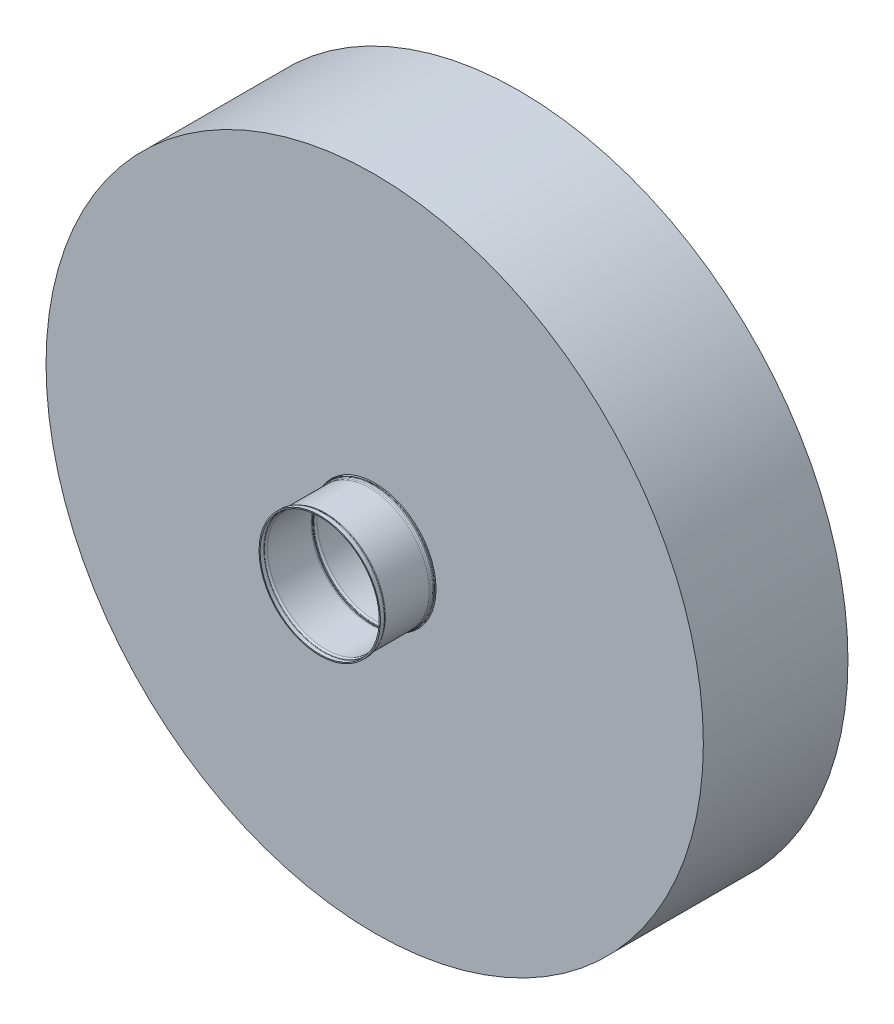
from build123d import *
from build123d.topology import SkipClean

# Parameters (mm, degrees)
SKETCH1_R             = 150
SKETCH1_R_2           = 28
BOSS_EXTRUDE1_DEPTH   = 66
BOSS_EXTRUDE4_START   = -4
SKETCH5_R             = 3.6
SKETCH5_R_2           = 1.6
BOSS_EXTRUDE4_DEPTH   = 4
BOSS_EXTRUDE4_2_DEPTH = 4
BOSS_EXTRUDE4_3_DEPTH = 4
BOSS_EXTRUDE4_4_DEPTH = 4
BOSS_EXTRUDE4_5_DEPTH = 4
BOSS_EXTRUDE4_6_DEPTH = 4
BOSS_EXTRUDE4_7_DEPTH = 4
SKETCH5_R_3           = 4
BOSS_EXTRUDE4_8_DEPTH = 4
SKETCH6_R             = 4
BOSS_EXTRUDE5_DEPTH   = 4


with BuildPart() as part:
    # Sketch1 → Boss-Extrude1 (new body)
    with BuildSketch(Plane.XY):
        Circle(SKETCH1_R)
        Circle(SKETCH1_R_2, mode=Mode.SUBTRACT)
    extrude(amount=BOSS_EXTRUDE1_DEPTH)


with BuildPart() as body_2:
    # Sketch3 → Revolve1 (revolve)
    with BuildSketch(Plane(origin=(0, 0, 0), x_dir=(0, 0, -1), z_dir=(1, 0, 0)), mode=Mode.PRIVATE) as revolve1_sk:
        with BuildLine():
            Line((2.33137085, 27.2), (22.257086418, 27.2))
            ThreePointArc((22.257086418, 27.2), (22.563233164, 27.260896374), (22.822771843, 27.434314575))
            Line((22.822771843, 27.434314575), (22.854142693, 27.465685425))
            ThreePointArc((22.854142693, 27.465685425), (23.113681372, 27.639103626), (23.419828118, 27.7))
            Line((23.419828118, 27.7), (25.088457268, 27.7))
            Line((25.088457268, 27.7), (25.088457268, 27.2))
            Line((25.088457268, 27.2), (23.419828118, 27.2))
            ThreePointArc((23.419828118, 27.2), (23.305023088, 27.17716386), (23.207696084, 27.112132034))
            Line((23.207696084, 27.112132034), (23.176325234, 27.080761184))
            ThreePointArc((23.176325234, 27.080761184), (22.75457488, 26.798956608), (22.257086418, 26.7))
            Line((22.257086418, 26.7), (2.33137085, 26.7))
            ThreePointArc((2.33137085, 26.7), (1.833882388, 26.798956608), (1.412132034, 27.080761184))
            Line((1.412132034, 27.080761184), (1.380761184, 27.112132034))
            ThreePointArc((1.380761184, 27.112132034), (1.28343418, 27.17716386), (1.16862915, 27.2))
            Line((1.16862915, 27.2), (0.83137085, 27.2))
            ThreePointArc((0.83137085, 27.2), (0.71656582, 27.17716386), (0.619238816, 27.112132034))
            Line((0.619238816, 27.112132034), (0.587867966, 27.080761184))
            ThreePointArc((0.587867966, 27.080761184), (0.166117612, 26.798956608), (-0.33137085, 26.7))
            Line((-0.33137085, 26.7), (-65.66862915, 26.7))
            ThreePointArc((-65.66862915, 26.7), (-66.166117612, 26.798956608), (-66.587867966, 27.080761184))
            Line((-66.587867966, 27.080761184), (-66.619238816, 27.112132034))
            ThreePointArc((-66.619238816, 27.112132034), (-66.71656582, 27.17716386), (-66.83137085, 27.2))
            Line((-66.83137085, 27.2), (-67.16862915, 27.2))
            ThreePointArc((-67.16862915, 27.2), (-67.28343418, 27.17716386), (-67.380761184, 27.112132034))
            Line((-67.380761184, 27.112132034), (-67.412132034, 27.080761184))
            ThreePointArc((-67.412132034, 27.080761184), (-67.833882388, 26.798956608), (-68.33137085, 26.7))
            Line((-68.33137085, 26.7), (-88.257086418, 26.7))
            ThreePointArc((-88.257086418, 26.7), (-88.75457488, 26.798956608), (-89.176325234, 27.080761184))
            Line((-89.176325234, 27.080761184), (-89.207696084, 27.112132034))
            ThreePointArc((-89.207696084, 27.112132034), (-89.305023088, 27.17716386), (-89.419828118, 27.2))
            Line((-89.419828118, 27.2), (-91.088457268, 27.2))
            Line((-91.088457268, 27.2), (-91.088457268, 27.7))
            Line((-91.088457268, 27.7), (-89.419828118, 27.7))
            ThreePointArc((-89.419828118, 27.7), (-89.113681372, 27.639103626), (-88.854142693, 27.465685425))
            Line((-88.854142693, 27.465685425), (-88.822771843, 27.434314575))
            ThreePointArc((-88.822771843, 27.434314575), (-88.563233164, 27.260896374), (-88.257086418, 27.2))
            Line((-88.257086418, 27.2), (-68.33137085, 27.2))
            ThreePointArc((-68.33137085, 27.2), (-68.025224104, 27.260896374), (-67.765685425, 27.434314575))
            Line((-67.765685425, 27.434314575), (-67.734314575, 27.465685425))
            ThreePointArc((-67.734314575, 27.465685425), (-67.474775896, 27.639103626), (-67.16862915, 27.7))
            Line((-67.16862915, 27.7), (-66.83137085, 27.7))
            ThreePointArc((-66.83137085, 27.7), (-66.525224104, 27.639103626), (-66.265685425, 27.465685425))
            Line((-66.265685425, 27.465685425), (-66.234314575, 27.434314575))
            ThreePointArc((-66.234314575, 27.434314575), (-65.974775896, 27.260896374), (-65.66862915, 27.2))
            Line((-65.66862915, 27.2), (-0.33137085, 27.2))
            ThreePointArc((-0.33137085, 27.2), (-0.025224104, 27.260896374), (0.234314575, 27.434314575))
            Line((0.234314575, 27.434314575), (0.265685425, 27.465685425))
            ThreePointArc((0.265685425, 27.465685425), (0.525224104, 27.639103626), (0.83137085, 27.7))
            Line((0.83137085, 27.7), (1.16862915, 27.7))
            ThreePointArc((1.16862915, 27.7), (1.474775896, 27.639103626), (1.734314575, 27.465685425))
            Line((1.734314575, 27.465685425), (1.765685425, 27.434314575))
            ThreePointArc((1.765685425, 27.434314575), (2.025224104, 27.260896374), (2.33137085, 27.2))
        make_face()
    revolve(revolve1_sk.sketch.rotate(Axis((0, 0, 0), (0, 0, 1)), 90), axis=Axis((0, 0, 0), (0, 0, 1)))


with BuildPart() as body_3:
    # Sketch5 → Boss-Extrude4 (new body)
    with BuildSketch(Plane.XY.offset(BOSS_EXTRUDE4_START)):
        with Locations((28.326662781, -59.241204136)):
            Circle(SKETCH5_R)
        with Locations((28.326662781, -59.241204136)):
            Circle(SKETCH5_R_2, mode=Mode.SUBTRACT)
    extrude(amount=-BOSS_EXTRUDE4_DEPTH)


with BuildPart() as body_4:
    # Sketch5 → Boss-Extrude4 2 (new body)
    with BuildSketch(Plane.XY.offset(BOSS_EXTRUDE4_START)):
        with Locations((-28.326662781, -59.241204136)):
            Circle(SKETCH5_R)
        with Locations((-28.326662781, -59.241204136)):
            Circle(SKETCH5_R_2, mode=Mode.SUBTRACT)
    extrude(amount=-BOSS_EXTRUDE4_2_DEPTH)


with BuildPart() as body_5:
    # Sketch5 → Boss-Extrude4 3 (new body)
    with BuildSketch(Plane.XY.offset(BOSS_EXTRUDE4_START)):
        with BuildLine():
            Line((0.305212717, -37.776572277), (-0.305212717, -37.776572277))
            ThreePointArc((-0.305212717, -37.776572277), (-2.9611956, -38.540329257), (-4.805768297, -40.598270307))
            ThreePointArc((-4.805768297, -40.598270307), (-14.539249585, -44.747209092), (-19.975116332, -35.669450352))
            ThreePointArc((-19.975116332, -35.669450352), (-20.257779592, -32.920328441), (-21.957589792, -30.741288495))
            Line((-21.957589792, -30.741288495), (-22.451434342, -30.382489427))
            ThreePointArc((-22.451434342, -30.382489427), (-25.04909472, -29.439234235), (-27.751012778, -30.01993089))
            ThreePointArc((-27.751012778, -30.01993089), (-30.524841853, -30.907867996), (-33.433080405, -30.750678418))
            ThreePointArc((-33.433080405, -30.750678418), (-37.696585084, -31.685186218), (-39.601662781, -35.61220238))
            Line((-39.601662781, -35.61220238), (-39.601662781, -64.241204136))
            ThreePointArc((-39.601662781, -64.241204136), (-38.137196687, -67.776738041), (-34.601662781, -69.241204136))
            Line((-34.601662781, -69.241204136), (-22.051662781, -69.241204136))
            ThreePointArc((-22.051662781, -69.241204136), (-18.516128875, -67.776738041), (-17.051662781, -64.241204136))
            Line((-17.051662781, -64.241204136), (-17.051662781, -54.241204136))
            ThreePointArc((-17.051662781, -54.241204136), (-15.587196687, -50.70567023), (-12.051662781, -49.241204136))
            Line((-12.051662781, -49.241204136), (12.051662781, -49.241204136))
            ThreePointArc((12.051662781, -49.241204136), (15.587196687, -50.70567023), (17.051662781, -54.241204136))
            Line((17.051662781, -54.241204136), (17.051662781, -64.241204136))
            ThreePointArc((17.051662781, -64.241204136), (18.516128875, -67.776738041), (22.051662781, -69.241204136))
            Line((22.051662781, -69.241204136), (34.601662781, -69.241204136))
            ThreePointArc((34.601662781, -69.241204136), (38.137196687, -67.776738041), (39.601662781, -64.241204136))
            Line((39.601662781, -64.241204136), (39.601662781, -35.61220238))
            ThreePointArc((39.601662781, -35.61220238), (37.696585084, -31.685186218), (33.433080405, -30.750678418))
            ThreePointArc((33.433080405, -30.750678418), (30.524841853, -30.907867996), (27.751012778, -30.01993089))
            ThreePointArc((27.751012778, -30.01993089), (25.04909472, -29.439234235), (22.451434342, -30.382489427))
            Line((22.451434342, -30.382489427), (21.957589792, -30.741288495))
            ThreePointArc((21.957589792, -30.741288495), (20.257779592, -32.920328441), (19.975116332, -35.669450352))
            ThreePointArc((19.975116332, -35.669450352), (14.539249585, -44.747209092), (4.805768297, -40.598270307))
            ThreePointArc((4.805768297, -40.598270307), (2.9611956, -38.540329257), (0.305212717, -37.776572277))
        make_face()
        with BuildLine():
            Line((37.601662781, -35.61220238), (37.601662781, -64.241204136))
            ThreePointArc((37.601662781, -64.241204136), (36.722983124, -66.362524479), (34.601662781, -67.241204136))
            Line((34.601662781, -67.241204136), (22.051662781, -67.241204136))
            ThreePointArc((22.051662781, -67.241204136), (19.930342437, -66.362524479), (19.051662781, -64.241204136))
            Line((19.051662781, -64.241204136), (19.051662781, -54.241204136))
            ThreePointArc((19.051662781, -54.241204136), (17.001410249, -49.291456667), (12.051662781, -47.241204136))
            Line((12.051662781, -47.241204136), (-12.051662781, -47.241204136))
            ThreePointArc((-12.051662781, -47.241204136), (-17.001410249, -49.291456667), (-19.051662781, -54.241204136))
            Line((-19.051662781, -54.241204136), (-19.051662781, -64.241204136))
            ThreePointArc((-19.051662781, -64.241204136), (-19.930342437, -66.362524479), (-22.051662781, -67.241204136))
            Line((-22.051662781, -67.241204136), (-34.601662781, -67.241204136))
            ThreePointArc((-34.601662781, -67.241204136), (-36.722983124, -66.362524479), (-37.601662781, -64.241204136))
            Line((-37.601662781, -64.241204136), (-37.601662781, -35.61220238))
            ThreePointArc((-37.601662781, -35.61220238), (-36.458616162, -33.255992682), (-33.900513355, -32.695288003))
            ThreePointArc((-33.900513355, -32.695288003), (-30.269731064, -32.891530892), (-26.806751908, -31.782988294))
            ThreePointArc((-26.806751908, -31.782988294), (-25.185601073, -31.434570301), (-23.627004846, -32.000523416))
            Line((-23.627004846, -32.000523416), (-23.133160296, -32.359322484))
            ThreePointArc((-23.133160296, -32.359322484), (-22.113274176, -33.666746451), (-21.94367622, -35.316219598))
            ThreePointArc((-21.94367622, -35.316219598), (-15.157283574, -46.649322124), (-3.005546065, -41.469591095))
            ThreePointArc((-3.005546065, -41.469591095), (-1.898802447, -40.234826465), (-0.305212717, -39.776572277))
            Line((-0.305212717, -39.776572277), (0.305212717, -39.776572277))
            ThreePointArc((0.305212717, -39.776572277), (1.898802447, -40.234826465), (3.005546065, -41.469591095))
            ThreePointArc((3.005546065, -41.469591095), (15.157283574, -46.649322124), (21.94367622, -35.316219598))
            ThreePointArc((21.94367622, -35.316219598), (22.113274176, -33.666746451), (23.133160296, -32.359322484))
            Line((23.133160296, -32.359322484), (23.627004846, -32.000523416))
            ThreePointArc((23.627004846, -32.000523416), (25.185601073, -31.434570301), (26.806751908, -31.782988294))
            ThreePointArc((26.806751908, -31.782988294), (30.269731064, -32.891530892), (33.900513355, -32.695288003))
            ThreePointArc((33.900513355, -32.695288003), (36.458616162, -33.255992682), (37.601662781, -35.61220238))
        make_face(mode=Mode.SUBTRACT)
    extrude(amount=-BOSS_EXTRUDE4_3_DEPTH)



with BuildPart() as body_6:
    # Sketch5 → Boss-Extrude4 4 (new body)
    with BuildSketch(Plane.XY.offset(BOSS_EXTRUDE4_START)):
        with BuildLine():
            Line((19.151662781, -46.450691301), (19.151662781, -64.241204136))
            ThreePointArc((19.151662781, -64.241204136), (20.001053115, -66.291813801), (22.051662781, -67.141204136))
            Line((22.051662781, -67.141204136), (26.276662781, -67.141204136))
            ThreePointArc((26.276662781, -67.141204136), (27.690876343, -66.555417698), (28.276662781, -65.141204136))
            Line((28.276662781, -65.141204136), (28.276662781, -64.559803575))
            ThreePointArc((28.276662781, -64.559803575), (27.925692267, -63.428122633), (26.995961026, -62.693628333))
            ThreePointArc((26.995961026, -62.693628333), (24.626662781, -59.241204136), (26.995961026, -55.788779938))
            ThreePointArc((26.995961026, -55.788779938), (27.925692267, -55.054285638), (28.276662781, -53.922604696))
            Line((28.276662781, -53.922604696), (28.276662781, -52.241204136))
            ThreePointArc((28.276662781, -52.241204136), (28.19144879, -51.531258703), (27.940647769, -50.861644792))
            Line((27.940647769, -50.861644792), (23.846663916, -42.955996098))
            ThreePointArc((23.846663916, -42.955996098), (22.188010492, -41.879147261), (20.414639024, -42.754297667))
            ThreePointArc((20.414639024, -42.754297667), (20.342811824, -42.858946114), (20.269675203, -42.962683662))
            ThreePointArc((20.269675203, -42.962683662), (19.437998218, -44.619288214), (19.151662781, -46.450691301))
        make_face()
        with BuildLine():
            Line((26.164657777, -51.781351021), (22.070673924, -43.875702327))
            ThreePointArc((22.070673924, -43.875702327), (21.984623516, -44.001073239), (21.897004396, -44.125352875))
            ThreePointArc((21.897004396, -44.125352875), (21.342553072, -45.22975591), (21.151662781, -46.450691301))
            Line((21.151662781, -46.450691301), (21.151662781, -64.241204136))
            ThreePointArc((21.151662781, -64.241204136), (21.415266678, -64.877600239), (22.051662781, -65.141204136))
            Line((22.051662781, -65.141204136), (26.276662781, -65.141204136))
            Line((26.276662781, -65.141204136), (26.276662781, -64.559803575))
            ThreePointArc((26.276662781, -64.559803575), (22.626662781, -59.241204136), (26.276662781, -53.922604696))
            Line((26.276662781, -53.922604696), (26.276662781, -52.241204136))
            ThreePointArc((26.276662781, -52.241204136), (26.248258117, -52.004555658), (26.164657777, -51.781351021))
        make_face(mode=Mode.SUBTRACT)
    extrude(amount=-BOSS_EXTRUDE4_4_DEPTH)


with BuildPart() as body_7:
    # Sketch5 → Boss-Extrude4 5 (new body)
    with BuildSketch(Plane.XY.offset(BOSS_EXTRUDE4_START)):
        with BuildLine():
            Line((28.376662781, -53.922604696), (28.376662781, -52.241204136))
            ThreePointArc((28.376662781, -52.241204136), (29.255342437, -50.119883792), (31.376662781, -49.241204136))
            Line((31.376662781, -49.241204136), (32.501662781, -49.241204136))
            ThreePointArc((32.501662781, -49.241204136), (36.037196687, -50.70567023), (37.501662781, -54.241204136))
            Line((37.501662781, -54.241204136), (37.501662781, -64.241204136))
            ThreePointArc((37.501662781, -64.241204136), (36.652272446, -66.291813801), (34.601662781, -67.141204136))
            Line((34.601662781, -67.141204136), (30.376662781, -67.141204136))
            ThreePointArc((30.376662781, -67.141204136), (28.962449218, -66.555417698), (28.376662781, -65.141204136))
            Line((28.376662781, -65.141204136), (28.376662781, -64.559803575))
            ThreePointArc((28.376662781, -64.559803575), (28.727633295, -63.428122633), (29.657364535, -62.693628333))
            ThreePointArc((29.657364535, -62.693628333), (32.026662781, -59.241204136), (29.657364535, -55.788779938))
            ThreePointArc((29.657364535, -55.788779938), (28.727633295, -55.054285638), (28.376662781, -53.922604696))
        make_face()
        with BuildLine():
            Line((31.376662781, -51.241204136), (32.501662781, -51.241204136))
            ThreePointArc((32.501662781, -51.241204136), (34.622983124, -52.119883792), (35.501662781, -54.241204136))
            Line((35.501662781, -54.241204136), (35.501662781, -64.241204136))
            ThreePointArc((35.501662781, -64.241204136), (35.238058884, -64.877600239), (34.601662781, -65.141204136))
            Line((34.601662781, -65.141204136), (30.376662781, -65.141204136))
            Line((30.376662781, -65.141204136), (30.376662781, -64.559803575))
            ThreePointArc((30.376662781, -64.559803575), (34.026662781, -59.241204136), (30.376662781, -53.922604696))
            Line((30.376662781, -53.922604696), (30.376662781, -52.241204136))
            ThreePointArc((30.376662781, -52.241204136), (30.669555999, -51.534097354), (31.376662781, -51.241204136))
        make_face(mode=Mode.SUBTRACT)
    extrude(amount=-BOSS_EXTRUDE4_5_DEPTH)


with BuildPart() as body_8:
    # Sketch5 → Boss-Extrude4 6 (new body)
    with BuildSketch(Plane.XY.offset(BOSS_EXTRUDE4_START)):
        with BuildLine():
            Line((-31.376662781, -49.241204136), (-32.501662781, -49.241204136))
            ThreePointArc((-32.501662781, -49.241204136), (-36.037196687, -50.70567023), (-37.501662781, -54.241204136))
            Line((-37.501662781, -54.241204136), (-37.501662781, -64.241204136))
            ThreePointArc((-37.501662781, -64.241204136), (-36.652272446, -66.291813801), (-34.601662781, -67.141204136))
            Line((-34.601662781, -67.141204136), (-30.376662781, -67.141204136))
            ThreePointArc((-30.376662781, -67.141204136), (-28.962449218, -66.555417698), (-28.376662781, -65.141204136))
            Line((-28.376662781, -65.141204136), (-28.376662781, -64.559803575))
            ThreePointArc((-28.376662781, -64.559803575), (-28.727633295, -63.428122633), (-29.657364535, -62.693628333))
            ThreePointArc((-29.657364535, -62.693628333), (-32.026662781, -59.241204136), (-29.657364535, -55.788779938))
            ThreePointArc((-29.657364535, -55.788779938), (-28.727633295, -55.054285638), (-28.376662781, -53.922604696))
            Line((-28.376662781, -53.922604696), (-28.376662781, -52.241204136))
            ThreePointArc((-28.376662781, -52.241204136), (-29.255342437, -50.119883792), (-31.376662781, -49.241204136))
        make_face()
        with BuildLine():
            Line((-31.376662781, -51.241204136), (-32.501662781, -51.241204136))
            ThreePointArc((-32.501662781, -51.241204136), (-34.622983124, -52.119883792), (-35.501662781, -54.241204136))
            Line((-35.501662781, -54.241204136), (-35.501662781, -64.241204136))
            ThreePointArc((-35.501662781, -64.241204136), (-35.238058884, -64.877600239), (-34.601662781, -65.141204136))
            Line((-34.601662781, -65.141204136), (-30.376662781, -65.141204136))
            Line((-30.376662781, -65.141204136), (-30.376662781, -64.559803575))
            ThreePointArc((-30.376662781, -64.559803575), (-34.026662781, -59.241204136), (-30.376662781, -53.922604696))
            Line((-30.376662781, -53.922604696), (-30.376662781, -52.241204136))
            ThreePointArc((-30.376662781, -52.241204136), (-30.669555999, -51.534097354), (-31.376662781, -51.241204136))
        make_face(mode=Mode.SUBTRACT)
    extrude(amount=-BOSS_EXTRUDE4_6_DEPTH)


with BuildPart() as body_9:
    # Sketch5 → Boss-Extrude4 7 (new body)
    with BuildSketch(Plane.XY.offset(BOSS_EXTRUDE4_START)):
        with BuildLine():
            Line((-27.940647769, -50.861644792), (-23.846663916, -42.955996098))
            ThreePointArc((-23.846663916, -42.955996098), (-22.188010492, -41.879147261), (-20.414639024, -42.754297667))
            ThreePointArc((-20.414639024, -42.754297667), (-20.342811824, -42.858946114), (-20.269675203, -42.962683662))
            ThreePointArc((-20.269675203, -42.962683662), (-19.437998218, -44.619288214), (-19.151662781, -46.450691301))
            Line((-19.151662781, -46.450691301), (-19.151662781, -64.241204136))
            ThreePointArc((-19.151662781, -64.241204136), (-20.001053115, -66.291813801), (-22.051662781, -67.141204136))
            Line((-22.051662781, -67.141204136), (-26.276662781, -67.141204136))
            ThreePointArc((-26.276662781, -67.141204136), (-27.690876343, -66.555417698), (-28.276662781, -65.141204136))
            Line((-28.276662781, -65.141204136), (-28.276662781, -64.559803575))
            ThreePointArc((-28.276662781, -64.559803575), (-27.925692267, -63.428122633), (-26.995961026, -62.693628333))
            ThreePointArc((-26.995961026, -62.693628333), (-24.626662781, -59.241204136), (-26.995961026, -55.788779938))
            ThreePointArc((-26.995961026, -55.788779938), (-27.925692267, -55.054285638), (-28.276662781, -53.922604696))
            Line((-28.276662781, -53.922604696), (-28.276662781, -52.241204136))
            ThreePointArc((-28.276662781, -52.241204136), (-28.19144879, -51.531258703), (-27.940647769, -50.861644792))
        make_face()
        with BuildLine():
            Line((-26.164657777, -51.781351021), (-22.070673924, -43.875702327))
            ThreePointArc((-22.070673924, -43.875702327), (-21.984623516, -44.001073239), (-21.897004396, -44.125352875))
            ThreePointArc((-21.897004396, -44.125352875), (-21.342553072, -45.22975591), (-21.151662781, -46.450691301))
            Line((-21.151662781, -46.450691301), (-21.151662781, -64.241204136))
            ThreePointArc((-21.151662781, -64.241204136), (-21.415266678, -64.877600239), (-22.051662781, -65.141204136))
            Line((-22.051662781, -65.141204136), (-26.276662781, -65.141204136))
            Line((-26.276662781, -65.141204136), (-26.276662781, -64.559803575))
            ThreePointArc((-26.276662781, -64.559803575), (-22.626662781, -59.241204136), (-26.276662781, -53.922604696))
            Line((-26.276662781, -53.922604696), (-26.276662781, -52.241204136))
            ThreePointArc((-26.276662781, -52.241204136), (-26.248258117, -52.004555658), (-26.164657777, -51.781351021))
        make_face(mode=Mode.SUBTRACT)
    extrude(amount=-BOSS_EXTRUDE4_7_DEPTH)


with BuildPart() as body_10:
    # Sketch5 → Boss-Extrude4 8 (new body)
    with BuildSketch(Plane.XY.offset(BOSS_EXTRUDE4_START)):
        with BuildLine():
            ThreePointArc((25.503373671, -28.159863838), (38.944226537, -19.865847687), (23.571727074, -23.489863405))
            ThreePointArc((23.571727074, -23.489863405), (23.434080888, -24.373242778), (22.925289594, -25.108386986))
            ThreePointArc((22.925289594, -25.108386986), (19.984698578, -27.506577809), (16.795190972, -29.562164336))
            ThreePointArc((16.795190972, -29.562164336), (15.938802125, -29.818881559), (15.056123405, -29.676811621))
            ThreePointArc((15.056123405, -29.676811621), (9.579526826, -29.482752005), (5.262932502, -32.858812235))
            ThreePointArc((5.262932502, -32.858812235), (4.632337031, -33.492574762), (3.788609303, -33.788258901))
            ThreePointArc((3.788609303, -33.788258901), (0, -34), (-3.788609303, -33.788258901))
            ThreePointArc((-3.788609303, -33.788258901), (-4.632337031, -33.492574762), (-5.262932502, -32.858812235))
            ThreePointArc((-5.262932502, -32.858812235), (-9.579526826, -29.482752005), (-15.056123405, -29.676811621))
            ThreePointArc((-15.056123405, -29.676811621), (-15.938802125, -29.818881559), (-16.795190972, -29.562164336))
            ThreePointArc((-16.795190972, -29.562164336), (-19.984698578, -27.506577809), (-22.925289594, -25.108386986))
            ThreePointArc((-22.925289594, -25.108386986), (-23.434080888, -24.373242778), (-23.571727074, -23.489863405))
            ThreePointArc((-23.571727074, -23.489863405), (-38.944226537, -19.865847687), (-25.503373671, -28.159863838))
            ThreePointArc((-25.503373671, -28.159863838), (-24.16502505, -27.476482851), (-22.728601321, -27.917927609))
            ThreePointArc((-22.728601321, -27.917927609), (-21.160269083, -29.124611797), (-19.528002908, -30.243298471))
            ThreePointArc((-19.528002908, -30.243298471), (-18.66428465, -31.473004687), (-18.900646123, -32.957026203))
            ThreePointArc((-18.900646123, -32.957026203), (-14.523798736, -44.699656266), (-4.080710043, -37.772315332))
            ThreePointArc((-4.080710043, -37.772315332), (-3.399644531, -36.432786918), (-1.978078603, -35.945614545))
            ThreePointArc((-1.978078603, -35.945614545), (0, -36), (1.978078603, -35.945614545))
            ThreePointArc((1.978078603, -35.945614545), (3.399644531, -36.432786918), (4.080710043, -37.772315332))
            ThreePointArc((4.080710043, -37.772315332), (14.523798736, -44.699656266), (18.900646123, -32.957026203))
            ThreePointArc((18.900646123, -32.957026203), (18.66428465, -31.473004687), (19.528002908, -30.243298471))
            ThreePointArc((19.528002908, -30.243298471), (21.160269083, -29.124611797), (22.728601321, -27.917927609))
            ThreePointArc((22.728601321, -27.917927609), (24.16502505, -27.476482851), (25.503373671, -28.159863838))
        make_face()
        with Locations((31.551662781, -22.923624839)):
            Circle(SKETCH5_R_3, mode=Mode.SUBTRACT)
        with Locations((12.051662781, -37.091204136)):
            Circle(SKETCH5_R_3, mode=Mode.SUBTRACT)
        with Locations((-12.051662781, -37.091204136)):
            Circle(SKETCH5_R_3, mode=Mode.SUBTRACT)
        with Locations((-31.551662781, -22.923624839)):
            Circle(SKETCH5_R_3, mode=Mode.SUBTRACT)
    extrude(amount=-BOSS_EXTRUDE4_8_DEPTH)


with BuildPart() as body_5_1:
    with SkipClean():  # the faces are left unmerged after this step: merging them gives an invalid solid
        add(body_5.part)

        add(body_10.part)  # Boss-Extrude5 merges body 10
        # Sketch6 → Boss-Extrude5 (add)
        # profile 1 of 2: a face of its own
        with BuildSketch(Plane(origin=(0, 0, -8), x_dir=(-1, 0, 0), z_dir=(0, 0, -1))):
            with BuildLine():
                Line((-36.601662781, -49.241204136), (36.601662781, -49.241204136))
                ThreePointArc((36.601662781, -49.241204136), (38.722983124, -48.362524479), (39.601662781, -46.241204136))
                Line((39.601662781, -46.241204136), (39.601662781, -35.663620915))
                ThreePointArc((39.601662781, -35.663620915), (37.698385993, -31.738024738), (33.437540643, -30.801026993))
                ThreePointArc((33.437540643, -30.801026993), (30.239829546, -30.916690182), (27.246835897, -29.784999738))
                ThreePointArc((27.246835897, -29.784999738), (24.77215877, -29.465938934), (22.451434342, -30.382489427))
                Line((22.451434342, -30.382489427), (21.957589792, -30.741288495))
                ThreePointArc((21.957589792, -30.741288495), (20.368755184, -32.665198907), (19.907482754, -35.117351925))
                ThreePointArc((19.907482754, -35.117351925), (14.554700435, -44.794761918), (4.535969698, -40.111859278))
                ThreePointArc((4.535969698, -40.111859278), (2.721453082, -38.399154945), (0.305212717, -37.776572277))
                Line((0.305212717, -37.776572277), (-0.305212717, -37.776572277))
                ThreePointArc((-0.305212717, -37.776572277), (-2.721453082, -38.399154945), (-4.535969698, -40.111859278))
                ThreePointArc((-4.535969698, -40.111859278), (-14.554700435, -44.794761918), (-19.907482754, -35.117351925))
                ThreePointArc((-19.907482754, -35.117351925), (-20.368755184, -32.665198907), (-21.957589792, -30.741288495))
                Line((-21.957589792, -30.741288495), (-22.451434342, -30.382489427))
                ThreePointArc((-22.451434342, -30.382489427), (-24.77215877, -29.465938934), (-27.246835897, -29.784999738))
                ThreePointArc((-27.246835897, -29.784999738), (-30.239829546, -30.916690182), (-33.437540643, -30.801026993))
                ThreePointArc((-33.437540643, -30.801026993), (-37.698385993, -31.738024738), (-39.601662781, -35.663620915))
                Line((-39.601662781, -35.663620915), (-39.601662781, -46.241204136))
                ThreePointArc((-39.601662781, -46.241204136), (-38.722983124, -48.362524479), (-36.601662781, -49.241204136))
            make_face()
            with BuildLine():
                Line((-23.627004846, -32.000523416), (-23.133160296, -32.359322484))
                ThreePointArc((-23.133160296, -32.359322484), (-22.212046636, -33.447111002), (-21.896947245, -34.837235675))
                ThreePointArc((-21.896947245, -34.837235675), (-15.172734424, -46.69687495), (-2.761810915, -41.054618359))
                ThreePointArc((-2.761810915, -41.054618359), (-1.68979537, -40.115194649), (-0.305212717, -39.776572277))
                Line((-0.305212717, -39.776572277), (0.305212717, -39.776572277))
                ThreePointArc((0.305212717, -39.776572277), (1.68979537, -40.115194649), (2.761810915, -41.054618359))
                ThreePointArc((2.761810915, -41.054618359), (15.172734424, -46.69687495), (21.896947245, -34.837235675))
                ThreePointArc((21.896947245, -34.837235675), (22.212046636, -33.447111002), (23.133160296, -32.359322484))
                Line((23.133160296, -32.359322484), (23.627004846, -32.000523416))
                ThreePointArc((23.627004846, -32.000523416), (24.946192979, -31.460637406), (26.365651175, -31.590532225))
                ThreePointArc((26.365651175, -31.590532225), (30.021175966, -32.906991511), (33.903189498, -32.746064562))
                ThreePointArc((33.903189498, -32.746064562), (36.459696708, -33.308263209), (37.601662781, -35.663620915))
                Line((37.601662781, -35.663620915), (37.601662781, -46.241204136))
                ThreePointArc((37.601662781, -46.241204136), (37.308769562, -46.948310917), (36.601662781, -47.241204136))
                Line((36.601662781, -47.241204136), (-36.601662781, -47.241204136))
                ThreePointArc((-36.601662781, -47.241204136), (-37.308769562, -46.948310917), (-37.601662781, -46.241204136))
                Line((-37.601662781, -46.241204136), (-37.601662781, -35.663620915))
                ThreePointArc((-37.601662781, -35.663620915), (-36.459696708, -33.308263209), (-33.903189498, -32.746064562))
                ThreePointArc((-33.903189498, -32.746064562), (-30.021175966, -32.906991511), (-26.365651175, -31.590532225))
                ThreePointArc((-26.365651175, -31.590532225), (-24.946192979, -31.460637406), (-23.627004846, -32.000523416))
            make_face(mode=Mode.SUBTRACT)
        # profile 2 of 2: a face of its own
        with BuildSketch(Plane(origin=(0, 0, -8), x_dir=(-1, 0, 0), z_dir=(0, 0, -1))):
            with BuildLine():
                ThreePointArc((-23.571727074, -23.489863405), (-38.944226537, -19.865847687), (-25.503373671, -28.159863838))
                ThreePointArc((-25.503373671, -28.159863838), (-24.16502505, -27.476482851), (-22.728601321, -27.917927609))
                ThreePointArc((-22.728601321, -27.917927609), (-21.160269083, -29.124611797), (-19.528002908, -30.243298471))
                ThreePointArc((-19.528002908, -30.243298471), (-18.66428465, -31.473004687), (-18.900646123, -32.957026203))
                ThreePointArc((-18.900646123, -32.957026203), (-14.523798736, -44.699656266), (-4.080710043, -37.772315332))
                ThreePointArc((-4.080710043, -37.772315332), (-3.399644531, -36.432786918), (-1.978078603, -35.945614545))
                ThreePointArc((-1.978078603, -35.945614545), (0, -36), (1.978078603, -35.945614545))
                ThreePointArc((1.978078603, -35.945614545), (3.399644531, -36.432786918), (4.080710043, -37.772315332))
                ThreePointArc((4.080710043, -37.772315332), (14.523798736, -44.699656266), (18.900646123, -32.957026203))
                ThreePointArc((18.900646123, -32.957026203), (18.66428465, -31.473004687), (19.528002908, -30.243298471))
                ThreePointArc((19.528002908, -30.243298471), (21.160269083, -29.124611797), (22.728601321, -27.917927609))
                ThreePointArc((22.728601321, -27.917927609), (24.16502505, -27.476482851), (25.503373671, -28.159863838))
                ThreePointArc((25.503373671, -28.159863838), (38.944226537, -19.865847687), (23.571727074, -23.489863405))
                ThreePointArc((23.571727074, -23.489863405), (23.434080888, -24.373242778), (22.925289594, -25.108386986))
                ThreePointArc((22.925289594, -25.108386986), (19.984698578, -27.506577809), (16.795190972, -29.562164336))
                ThreePointArc((16.795190972, -29.562164336), (15.938802125, -29.818881559), (15.056123405, -29.676811621))
                ThreePointArc((15.056123405, -29.676811621), (9.579526826, -29.482752005), (5.262932502, -32.858812235))
                ThreePointArc((5.262932502, -32.858812235), (4.632337031, -33.492574762), (3.788609303, -33.788258901))
                ThreePointArc((3.788609303, -33.788258901), (0, -34), (-3.788609303, -33.788258901))
                ThreePointArc((-3.788609303, -33.788258901), (-4.632337031, -33.492574762), (-5.262932502, -32.858812235))
                ThreePointArc((-5.262932502, -32.858812235), (-9.579526826, -29.482752005), (-15.056123405, -29.676811621))
                ThreePointArc((-15.056123405, -29.676811621), (-15.938802125, -29.818881559), (-16.795190972, -29.562164336))
                ThreePointArc((-16.795190972, -29.562164336), (-19.984698578, -27.506577809), (-22.925289594, -25.108386986))
                ThreePointArc((-22.925289594, -25.108386986), (-23.434080888, -24.373242778), (-23.571727074, -23.489863405))
            make_face()
            with Locations(Location((31.551662781, -22.923624839, 0), (0, 0, 180))):
                Circle(SKETCH6_R, mode=Mode.SUBTRACT)
            with Locations(Location((12.051662781, -37.091204136, 0), (0, 0, 180))):
                Circle(SKETCH6_R, mode=Mode.SUBTRACT)
            with Locations(Location((-31.551662781, -22.923624839, 0), (0, 0, 180))):
                Circle(SKETCH6_R, mode=Mode.SUBTRACT)
            with Locations(Location((-12.051662781, -37.091204136, 0), (0, 0, 180))):
                Circle(SKETCH6_R, mode=Mode.SUBTRACT)
        extrude(amount=BOSS_EXTRUDE5_DEPTH)


solid = Compound([part.part, body_2.part, body_3.part, body_4.part, body_6.part, body_7.part, body_8.part, body_9.part, body_5_1.part])
